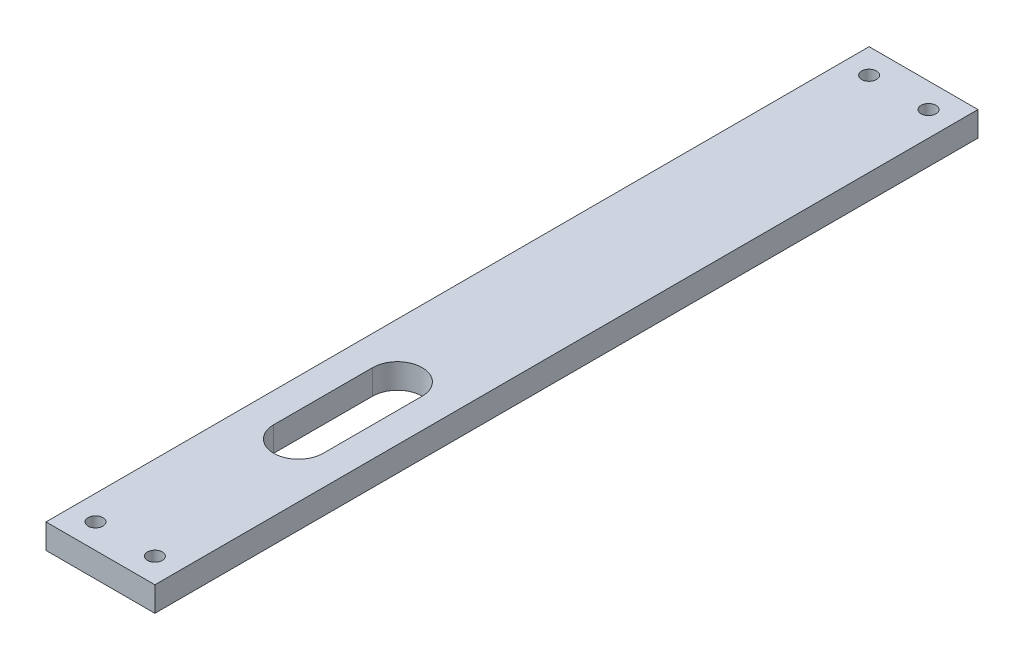
from build123d import *

# Parameters (mm, degrees)
SKETCH1_W           = 22
SKETCH1_H           = 166.3
SKETCH1_R           = 1.5
BOSS_EXTRUDE1_DEPTH = 5
CUT_EXTRUDE1_DEPTH  = 5


with BuildPart() as part:
    # Sketch1 → Boss-Extrude1 (new body)
    with BuildSketch(Plane(origin=(0, 0, 0), x_dir=(1, 0, 0), z_dir=(0, 1, 0))):
        with Locations((11, 83.15)):
            Rectangle(SKETCH1_W, SKETCH1_H)
        with Locations(Location((5, 161.3, 0), (0, 0, 270))):
            Circle(SKETCH1_R, mode=Mode.SUBTRACT)
        with Locations(Location((17, 161.3, 0), (0, 0, 270))):
            Circle(SKETCH1_R, mode=Mode.SUBTRACT)
        with Locations(Location((17, 5, 0), (0, 0, 270))):
            Circle(SKETCH1_R, mode=Mode.SUBTRACT)
        with Locations(Location((5, 5, 0), (0, 0, 270))):
            Circle(SKETCH1_R, mode=Mode.SUBTRACT)
    extrude(amount=BOSS_EXTRUDE1_DEPTH)

    # Sketch2 → Cut-Extrude1 (cut)
    with BuildSketch(Plane(origin=(0, 0, 0), x_dir=(-1, 0, 0), z_dir=(0, -1, 0))):
        with BuildLine():
            Line((-16, 40), (-16, 60))
            ThreePointArc((-16, 60), (-11, 65), (-6, 60))
            Line((-6, 60), (-6, 40))
            ThreePointArc((-6, 40), (-11, 35), (-16, 40))
        make_face()
    extrude(amount=-CUT_EXTRUDE1_DEPTH, mode=Mode.SUBTRACT)


solid = part.part
